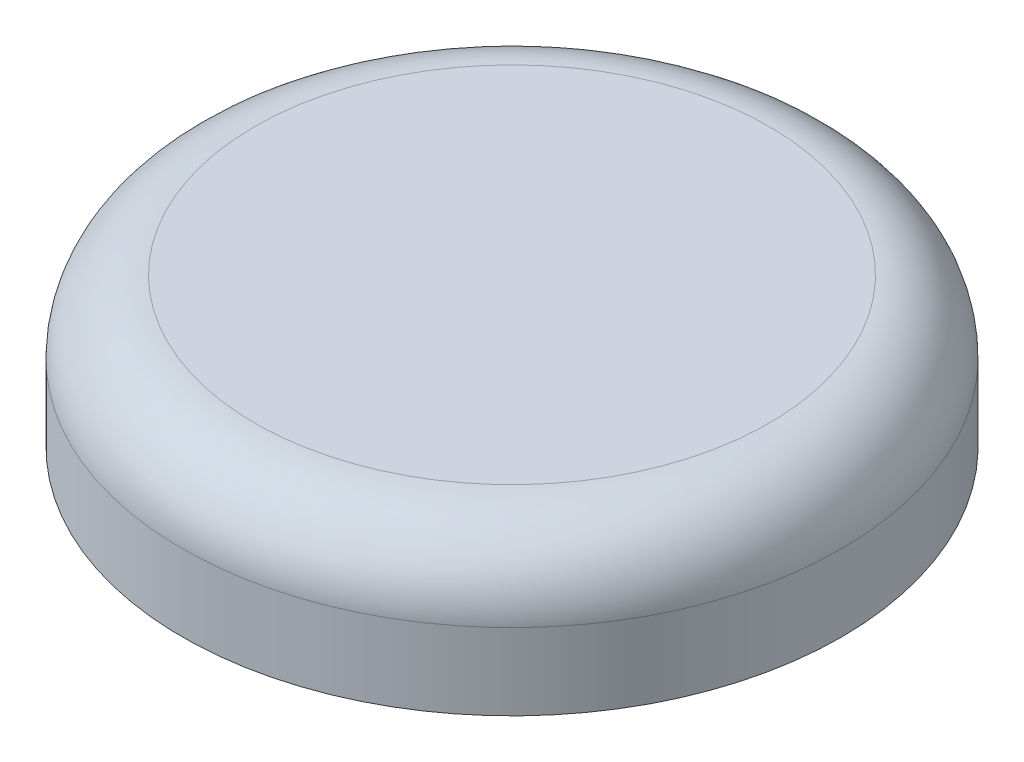
from build123d import *


with BuildPart() as part:
    # Sketch1 → Revolve1 (revolve)
    with BuildSketch(Plane.XY):
        with BuildLine():
            Line((0, 0), (0, 2))
            Line((0, 2), (-19.5, 2))
            ThreePointArc((-19.5, 2), (-23.389087297, 0.389087297), (-25, -3.5))
            Line((-25, -3.5), (-25, -9.3))
            Line((-25, -9.3), (-24, -9.3))
            Line((-24, -9.3), (-24, -4.3))
            Line((-24, -4.3), (-23, -4.3))
            Line((-23, -4.3), (-23, -3.5))
            ThreePointArc((-23, -3.5), (-21.974873734, -1.025126266), (-19.5, 0))
            Line((-19.5, 0), (0, 0))
        make_face()
    revolve(axis=Axis((0, 0, 0), (0, -1, 0)))


solid = part.part
